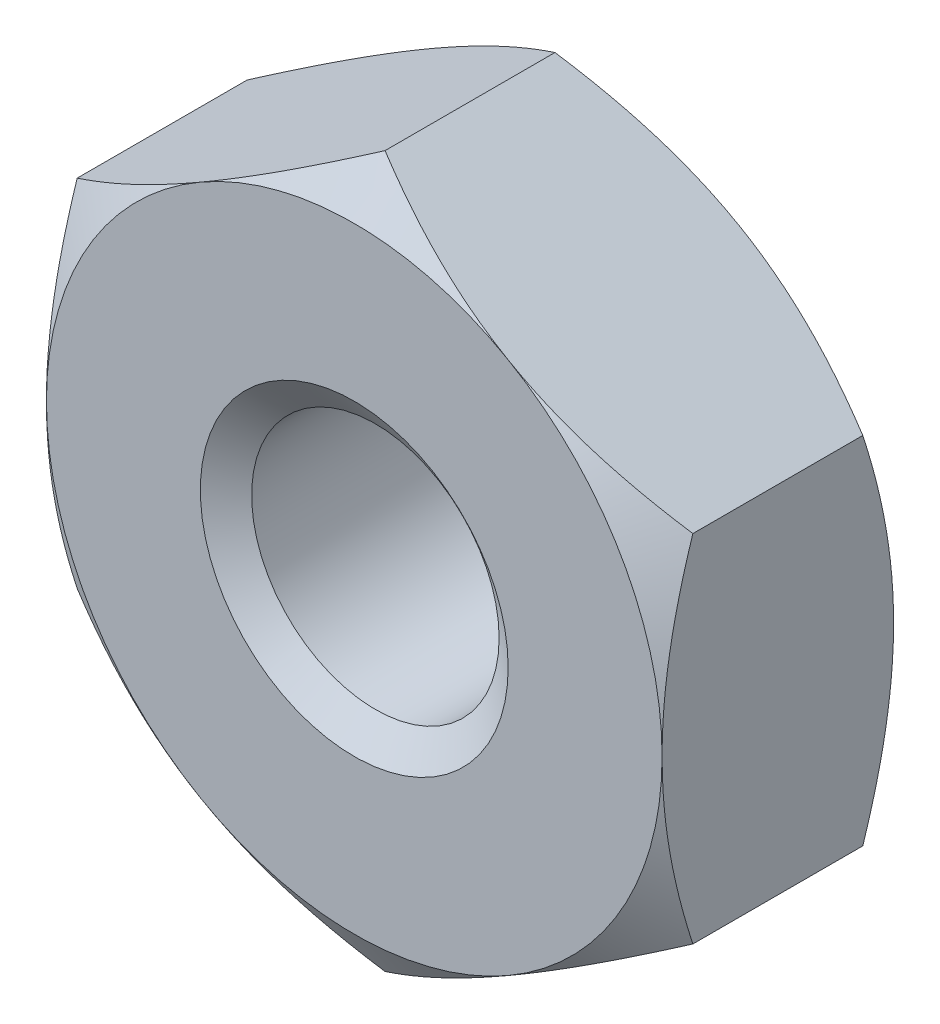
from build123d import *

# Parameters (mm, degrees)
BASENUT_START = -4.7752
BASENUTSKE_R  = 2.5527
BASENUT_DEPTH = 4.7752


with BuildPart() as part:
    # BaseNutSke → BaseNut (new body)
    with BuildSketch(Plane.XY.offset(BASENUT_START)):
        Polygon((6.35, 3.666174209), (6.35, -3.666174209), (0, -7.332348419), (-6.35, -3.666174209), (-6.35, 3.666174209), (0, 7.332348419), align=None)
        Circle(BASENUTSKE_R, mode=Mode.SUBTRACT)
    extrude(amount=BASENUT_DEPTH)

    # Sketch3 → Double-Chamfer (revolve, cut)
    with BuildSketch(Plane(origin=(0, 0, 0), x_dir=(0, 0, -1), z_dir=(1, 0, 0))):
        Polygon((4.7752, 6.35), (4.1402, 7.332348419), (4.1402, 20.032348419), (17.4752, 20.032348419), (17.4752, 6.35), align=None)
        Polygon((0.635, 20.032348419), (-12.7, 20.032348419), (-12.7, 6.35), (0, 6.35), (0.635, 7.332348419), align=None)
    revolve(axis=Axis((0, 0, 0), (0, 0, -1)), mode=Mode.SUBTRACT)

    # EndChamferSke → EndChamfer (revolve, cut)
    with BuildSketch(Plane(origin=(0, 0, 0), x_dir=(0, 0, -1), z_dir=(1, 0, 0)), mode=Mode.PRIVATE) as endchamfer_sk:
        Polygon((4.7498, 3.175), (4.270486934, 2.49047), (4.8006, 2.49047), (4.8006, 3.175), align=None)
        Polygon((-0.0508, 3.175), (0, 3.175), (0.479313066, 2.49047), (-0.0508, 2.49047), align=None)
    revolve(endchamfer_sk.sketch.rotate(Axis((0, 0, -25.037505729), (0, 0, -1)), 90), axis=Axis((0, 0, -25.037505729), (0, 0, -1)), mode=Mode.SUBTRACT)


solid = part.part
